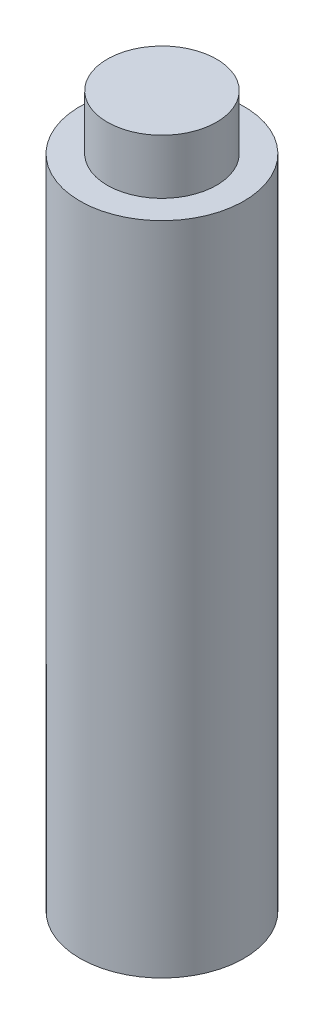
from build123d import *

# Parameters (mm, degrees)
SKETCH_1_R          = 7.5
EXTRUDE_1_DEPTH     = 60
SKETCH_2_R          = 5
EXTRUDE_2_DEPTH     = 5
SKETCH_3_R          = 5.1
CUT_EXTRUDE_1_DEPTH = 5


with BuildPart() as part:
    # ｽｹｯﾁ1 → ﾎﾞｽ - 押し出し1 (new body)
    with BuildSketch(Plane(origin=(0, 0, 0), x_dir=(1, 0, 0), z_dir=(0, 1, 0))):
        with Locations(Location((0, 0, 0), (0, 0, 270))):
            Circle(SKETCH_1_R)
    extrude(amount=EXTRUDE_1_DEPTH)

    # ｽｹｯﾁ2 → ﾎﾞｽ - 押し出し2 (add)
    with BuildSketch(Plane(origin=(0, 60, 0), x_dir=(1, 0, 0), z_dir=(0, 1, 0))):
        with Locations(Location((0, 0, 0), (0, 0, 270))):
            Circle(SKETCH_2_R)
    extrude(amount=EXTRUDE_2_DEPTH)

    # ｽｹｯﾁ3 → ｶｯﾄ - 押し出し1 (cut)
    with BuildSketch(Plane.XZ):
        with Locations(Location((0, 0, 0), (0, 0, 270))):
            Circle(SKETCH_3_R)
    extrude(amount=-CUT_EXTRUDE_1_DEPTH, mode=Mode.SUBTRACT)


solid = part.part
